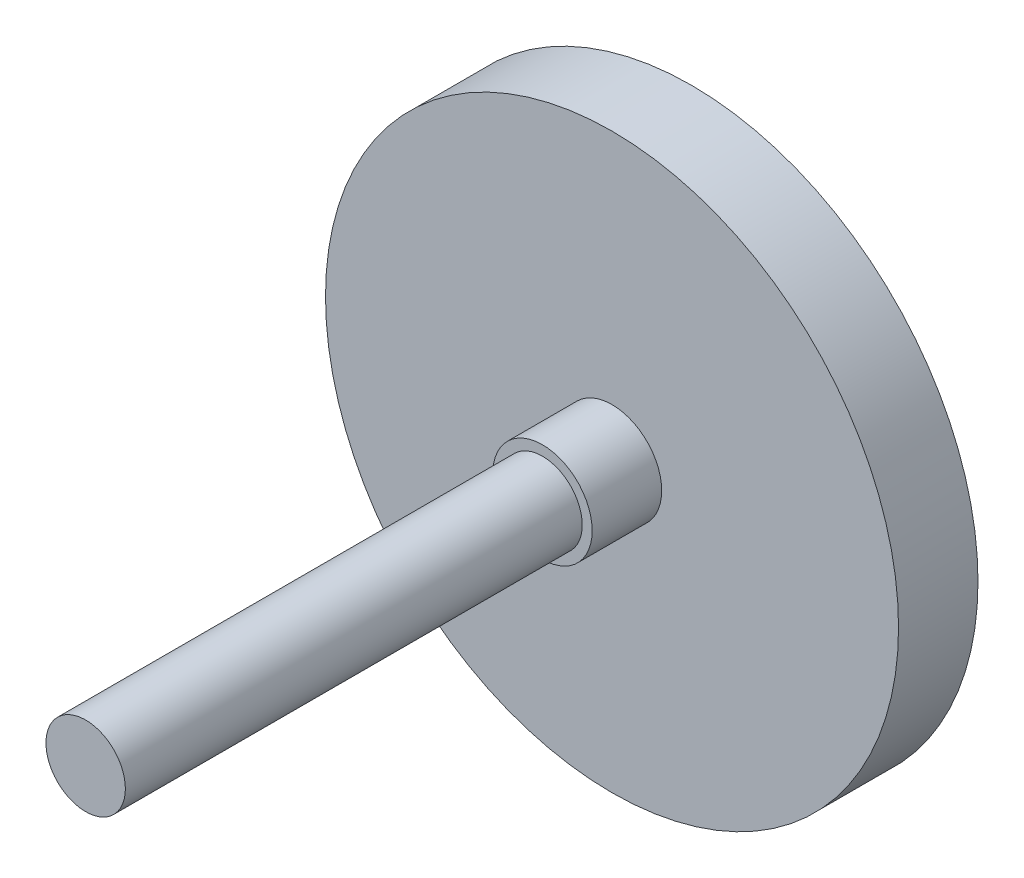
from build123d import *

# Parameters (mm, degrees)
ESQUISSE1_R             = 28.85
BOSS_EXTRU_1_DEPTH      = 8
ESQUISSE3_R             = 4
ENL_V_MAT_EXTRU_1_DEPTH = 2
ESQUISSE2_R             = 5
ESQUISSE2_R_2           = 4
BOSS_EXTRU_2_DEPTH      = 7
ESQUISSE2_2_R           = 5
ESQUISSE2_2_R_2         = 4
BOSS_EXTRU_3_DEPTH      = 2
ESQUISSE2_3_R           = 5
ESQUISSE2_3_R_2         = 4
BOSS_EXTRU_4_DEPTH      = 4
ESQUISSE4_R             = 4
BOSS_EXTRU_6_DEPTH      = 53


with BuildPart() as part:
    # Esquisse1 → Boss.-Extru.1 (new body)
    with BuildSketch(Plane.XY):
        Circle(ESQUISSE1_R)
    extrude(amount=BOSS_EXTRU_1_DEPTH)

    # Esquisse3 → Enlèv. mat.-Extru.1 (cut)
    with BuildSketch(Plane(origin=(0, 0, 0), x_dir=(-1, 0, 0), z_dir=(0, 0, -1))):
        Circle(ESQUISSE3_R)
    extrude(amount=-ENL_V_MAT_EXTRU_1_DEPTH, mode=Mode.SUBTRACT)

    # Esquisse2 → Boss.-Extru.2 (add)
    with BuildSketch(Plane.XY.offset(8)):
        Circle(ESQUISSE2_R)
        Circle(ESQUISSE2_R_2, mode=Mode.SUBTRACT)
    extrude(amount=BOSS_EXTRU_2_DEPTH)

    # Esquisse2<2> → Boss.-Extru.3 (add)
    with BuildSketch(Plane.XY.offset(8)):
        Circle(ESQUISSE2_2_R)
        Circle(ESQUISSE2_2_R_2, mode=Mode.SUBTRACT)
    extrude(amount=BOSS_EXTRU_3_DEPTH)

    # Esquisse2<3> → Boss.-Extru.4 (add)
    with BuildSketch(Plane.XY.offset(8)):
        Circle(ESQUISSE2_3_R)
        Circle(ESQUISSE2_3_R_2, mode=Mode.SUBTRACT)
    extrude(amount=BOSS_EXTRU_4_DEPTH)

    # Esquisse4 → Boss.-Extru.6 (add)
    with BuildSketch(Plane.XY.offset(8)):
        Circle(ESQUISSE4_R)
    extrude(amount=BOSS_EXTRU_6_DEPTH)


solid = part.part
